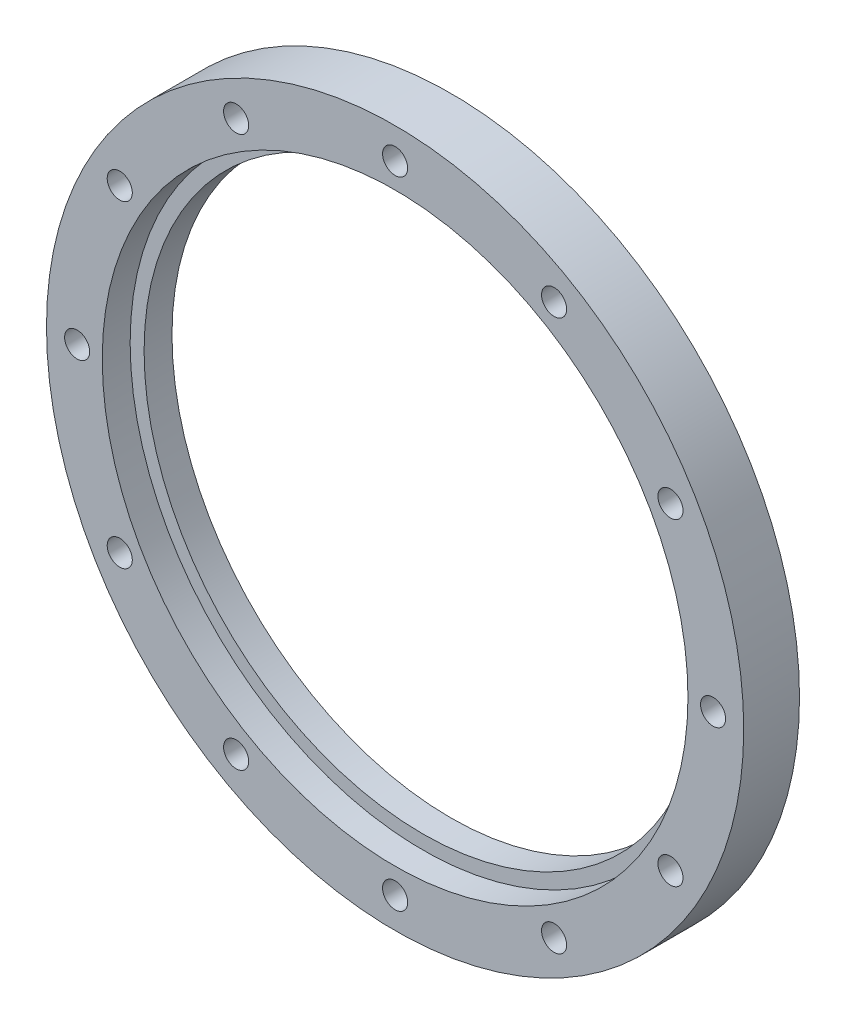
from build123d import *

# Parameters (mm, degrees)
SKETCH_1_R                = 62.5
EXTRUDE_1_DEPTH           = 10
SKETCH_2_R                = 50
CUT_EXTRUDE_1_DEPTH       = 89.952234373
SKETCH_3_R                = 52.5
CUT_EXTRUDE_2_DEPTH       = 5
HOLE_WIZARD_9_D           = 4.5
HOLE_WIZARD_9_CBORE_D     = 10
HOLE_WIZARD_9_CBORE_DEPTH = 3
PATTERN_CIRCULAR_1_COUNT  = 12


with BuildPart() as part:
    # 草图1 → 凸台-拉伸1 (new body)
    with BuildSketch(Plane.XY):
        Circle(SKETCH_1_R)
    extrude(amount=EXTRUDE_1_DEPTH)

    # 草图2 → 切除-拉伸1 (cut, through all)
    with BuildSketch(Plane.XY.offset(10)):
        Circle(SKETCH_2_R)
    extrude(amount=-CUT_EXTRUDE_1_DEPTH, mode=Mode.SUBTRACT)

    # 草图3 → 切除-拉伸2 (cut)
    with BuildSketch(Plane.XY.offset(10)):
        Circle(SKETCH_3_R)
    extrude(amount=-CUT_EXTRUDE_2_DEPTH, mode=Mode.SUBTRACT)

    # 打孔尺寸(%根据六角头螺)栓 全螺纹的类型9 (through all)
    with Locations(Plane(origin=(0, 0, 0), x_dir=(-1, 0, 0), z_dir=(0, 0, -1))):
        with Locations((0, 57)):
            hole_wizard_9 = CounterBoreHole(HOLE_WIZARD_9_D / 2, HOLE_WIZARD_9_CBORE_D / 2, HOLE_WIZARD_9_CBORE_DEPTH)

    # 阵列(圆周)1: 打孔尺寸(%根据六角头螺)栓 全螺纹的类型9 ×12 about axis
    pattern_circular_1_axis = Axis((0, 0, 0), (0, 0, 1))
    for i in range(1, PATTERN_CIRCULAR_1_COUNT):
        add(hole_wizard_9.rotate(pattern_circular_1_axis, i * 360 / PATTERN_CIRCULAR_1_COUNT), mode=Mode.SUBTRACT)


solid = part.part
